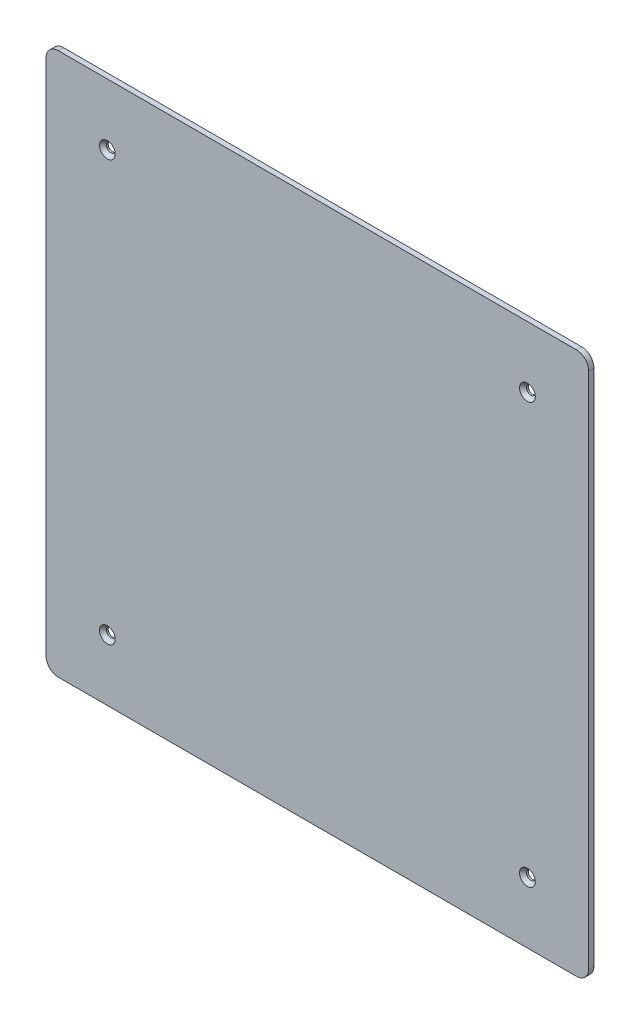
from build123d import *

# Parameters (mm, degrees)
SKETCH1_W           = 310
SKETCH1_H           = 310
BOSS_EXTRUDE1_DEPTH = 3
FILLET1_R           = 7
SKETCH2_R           = 2.5
CUT_EXTRUDE1_DEPTH  = 220.223630113
CHAMFER1_SIZE       = 2


with BuildPart() as part:
    # Sketch1 → Boss-Extrude1 (new body)
    with BuildSketch(Plane(origin=(0, 0, 0), x_dir=(0, 1, 0), z_dir=(0, 0, 1))):
        Rectangle(SKETCH1_W, SKETCH1_H)
    extrude(amount=BOSS_EXTRUDE1_DEPTH)

    # Fillet1
    fillet1_edges = [part.edges().sort_by_distance(p)[0] for p in [
        (155, 155, 1.5),
        (155, -155, 1.5),
        (-155, -155, 1.5),
        (-155, 155, 1.5),
    ]]
    fillet(fillet1_edges, radius=FILLET1_R)

    # Sketch2 → Cut-Extrude1 (cut, through all)
    with BuildSketch(Plane.XY.offset(3)):
        with Locations((-120, 120)):
            Circle(SKETCH2_R)
        with Locations((120, 120)):
            Circle(SKETCH2_R)
        with Locations((120, -120)):
            Circle(SKETCH2_R)
        with Locations((-120, -120)):
            Circle(SKETCH2_R)
    extrude(amount=-CUT_EXTRUDE1_DEPTH, mode=Mode.SUBTRACT)

    # Chamfer1
    chamfer1_edges = [part.edges().sort_by_distance(p)[0] for p in [
        (-122.5, -120, 3),
        (117.5, -120, 3),
        (117.5, 120, 3),
        (-122.5, 120, 3),
    ]]
    chamfer(chamfer1_edges, length=CHAMFER1_SIZE)


solid = part.part
